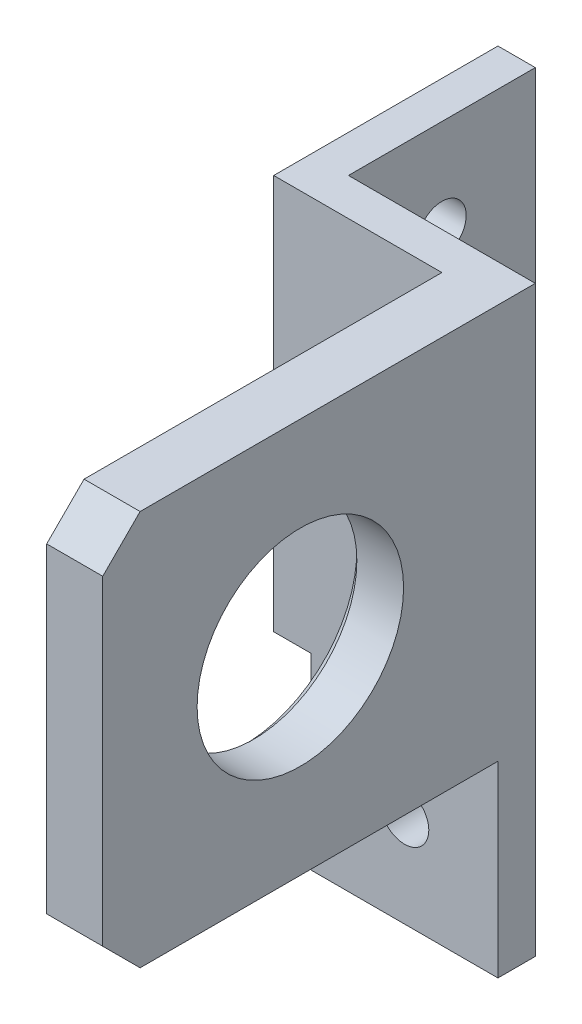
from build123d import *

# Parameters (mm, degrees)
SKICA2_W                 = 20
SKICA2_H                 = 42.3
P_IDAT_VYSUNUT_M1_DEPTH  = 4
SKICA3_W                 = 24
SKICA3_H                 = 42.3
P_IDAT_VYSUNUT_M2_DEPTH  = 4
SKICA4_W                 = 6
SKICA4_H                 = 42.3
P_IDAT_VYSUNUT_M3_DEPTH  = 42.3
SKICA5_R                 = 11.05
ODEBRAT_VYSUNUT_M1_DEPTH = 7
SKICA7_R                 = 2.6
ODEBRAT_VYSUNUT_M3_DEPTH = 4
ZKOSEN_1_SIZE            = 1
SKICA8_W                 = 20
SKICA8_H                 = 4
P_IDAT_VYSUNUT_M4_DEPTH  = 20.091596743
SKICA9_R                 = 2.6
ODEBRAT_VYSUNUT_M4_DEPTH = 4
ODEBRAT_VYSUNUT_M5_DEPTH = 80


with BuildPart() as part:
    # Skica2 → Přidat vysunutím1 (new body)
    with BuildSketch(Plane.XY):
        with Locations((-14.524287798, -61.15)):
            Rectangle(SKICA2_W, SKICA2_H)
    extrude(amount=P_IDAT_VYSUNUT_M1_DEPTH)

    # Skica3 → Přidat vysunutím2 (add)
    with BuildSketch(Plane.ZY.offset(24.524287798)):
        with Locations((-8, -61.15)):
            Rectangle(SKICA3_W, SKICA3_H)
    extrude(amount=P_IDAT_VYSUNUT_M2_DEPTH)

    # Skica4 → Přidat vysunutím3 (add)
    with BuildSketch(Plane.XY.offset(4)):
        with Locations((-7.524287798, -61.15)):
            Rectangle(SKICA4_W, SKICA4_H)
    extrude(amount=P_IDAT_VYSUNUT_M3_DEPTH)

    # Skica5 → Odebrat vysunutím1 (cut)
    with BuildSketch(Plane(origin=(-4.524287798, 0, 0), x_dir=(0, 0, -1), z_dir=(1, 0, 0))):
        with Locations((-25.15, -61.15)):
            Circle(SKICA5_R)
    extrude(amount=-ODEBRAT_VYSUNUT_M1_DEPTH, mode=Mode.SUBTRACT)

    # Skica7 → Odebrat vysunutím3 (cut)
    with BuildSketch(Plane.ZY.offset(28.524287798)):
        with Locations(Location((-10, -50, 0), (0, 0, 270))):
            Circle(SKICA7_R)
        with Locations(Location((-10, -70, 0), (0, 0, 270))):
            Circle(SKICA7_R)
    extrude(amount=-ODEBRAT_VYSUNUT_M3_DEPTH, mode=Mode.SUBTRACT)

    # Zkosení1
    zkosen_1_edges = [part.edges().sort_by_distance(p)[0] for p in [
        (-10.524287798, -61.15, 36.2),
    ]]
    chamfer(zkosen_1_edges, length=ZKOSEN_1_SIZE)

    # Skica8 → Přidat vysunutím4 (add)
    with BuildSketch(Plane.XZ.offset(82.3)):
        with Locations((-14.524287798, 2)):
            Rectangle(SKICA8_W, SKICA8_H)
    extrude(amount=P_IDAT_VYSUNUT_M4_DEPTH)

    # Skica9 → Odebrat vysunutím4 (cut)
    with BuildSketch(Plane.XY.offset(4)):
        with Locations((-14.524287798, -92.391596743)):
            Circle(SKICA9_R)
    extrude(amount=-ODEBRAT_VYSUNUT_M4_DEPTH, mode=Mode.SUBTRACT)

    # Skica10 → Odebrat vysunutím5 (cut)
    with BuildSketch(Plane.ZY.offset(10.524287798)):
        Polygon((46.3, -44), (42.3, -40), (46.565878614, -39.259270079), align=None)
        Polygon((42.3, -82.3), (46.3, -78.3), (47.745576453, -80.3), (46.3, -85.415433185), align=None)
    extrude(amount=-ODEBRAT_VYSUNUT_M5_DEPTH, mode=Mode.SUBTRACT)


solid = part.part
